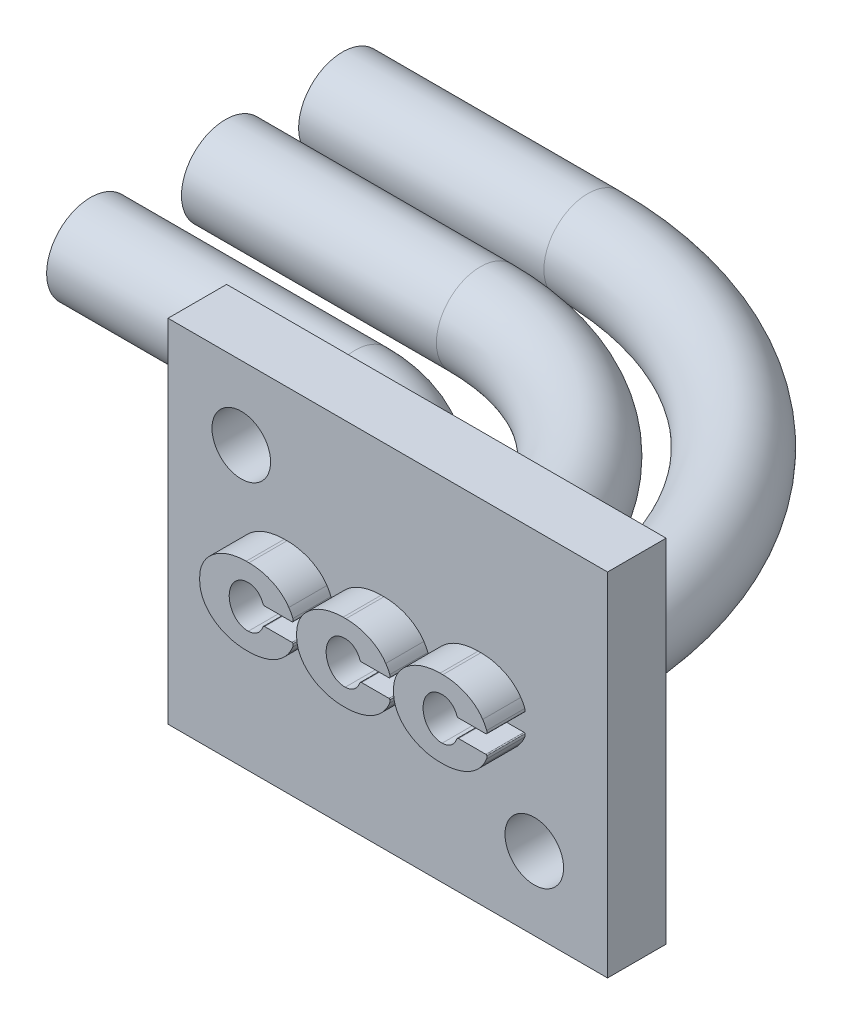
from build123d import *

# Parameters (mm, degrees)
SKETCH1_W           = 15
SKETCH1_H           = 12
BOSS_EXTRUDE1_DEPTH = 2
BOSS_EXTRUDE2_DEPTH = 2
SKETCH3_W           = 1.5
SKETCH3_H           = 4
BOSS_EXTRUDE3_DEPTH = 2
SKETCH12_W          = 14.1
SKETCH12_H          = 8
CUT_EXTRUDE1_DEPTH  = 22.443180832
SKETCH8_R           = 1.5
SKETCH7_R           = 1.5
SKETCH6_R           = 1.5
SKETCH13_R          = 1
CUT_EXTRUDE2_DEPTH  = 24.279403135
CUT_EXTRUDE3_START  = -0.7
CUT_EXTRUDE3_DEPTH  = 0.7


with BuildPart() as part:
    # Sketch1 → Boss-Extrude1 (new body)
    with BuildSketch(Plane.XY):
        Rectangle(SKETCH1_W, SKETCH1_H)
    extrude(amount=BOSS_EXTRUDE1_DEPTH)

    # Sketch2 → Boss-Extrude2 (add)
    with BuildSketch(Plane.XY.offset(2)):
        with BuildLine():
            Line((0.407238435, 0.442322853), (1.343073358, 0.442322853))
            ThreePointArc((1.343073358, 0.442322853), (1.361383578, 0.450410651), (1.372317406, 0.467177524))
            ThreePointArc((1.372317406, 0.467177524), (1.375503859, 0.511169305), (1.368128847, 0.554655388))
            ThreePointArc((1.368128847, 0.554655388), (1.307680997, 0.687640629), (1.230966735, 0.811954502))
            add(Edge.make_bspline(
                [(1.230966735, 0.811954502), (0.812669173, 1.453088874), (-0.130132299, 1.453088874)],
                knots=[0.342748392, 0.342748392, 0.342748392, 1.381331695, 1.381331695, 1.381331695], degree=2, weights=[1, 0.868170926, 1]))
            Line((-0.130132299, 1.453088874), (-0.223753352, 1.45308889))
            add(Edge.make_bspline(
                [(-0.223753352, 1.45308889), (-1.809410214, 1.45308889), (-1.809410214, 0.201933814)],
                knots=[4.81203319, 4.81203319, 4.81203319, 6.344970327, 6.344970327, 6.344970327], degree=2, weights=[1, 0.720364542, 1]))
            Line((-1.809410214, 0.201933814), (-1.809410207, 0.071803559))
            add(Edge.make_bspline(
                [(-1.809410207, 0.071803559), (-1.809410207, -1.179351517), (-0.223753345, -1.179351517)],
                knots=[3.079807634, 3.079807634, 3.079807634, 4.612744771, 4.612744771, 4.612744771], degree=2, weights=[1, 0.720364542, 1]))
            Line((-0.223753345, -1.179351517), (-0.130132292, -1.179351553))
            add(Edge.make_bspline(
                [(-0.130132292, -1.179351553), (0.81266918, -1.179351553), (1.230966742, -0.53821718)],
                knots=[1.760260959, 1.760260959, 1.760260959, 2.798844261, 2.798844261, 2.798844261], degree=2, weights=[1, 0.868170926, 1]))
            ThreePointArc((1.230966742, -0.53821718), (1.304716836, -0.419114346), (1.363380807, -0.291901532))
            ThreePointArc((1.363380807, -0.291901532), (1.374973795, -0.243578219), (1.373211686, -0.193915004))
            ThreePointArc((1.373211686, -0.193915004), (1.361207126, -0.172992015), (1.338547111, -0.164721302))
            Line((1.338547111, -0.164721302), (0.407238389, -0.164721302))
            ThreePointArc((0.407238389, -0.164721302), (0.369470559, -0.176722101), (0.34555702, -0.208322271))
            add(Edge.make_bspline(
                [(-0.150934559, -0.579205825), (0.214173352, -0.579565029), (0.34555702, -0.208322271)],
                knots=[5.955155363, 5.955155363, 5.955155363, 7.020735545, 7.020735545, 7.020735545], degree=2, weights=[1, 0.86139323, 1]))
            add(Edge.make_bspline(
                [(-0.210727715, 0.853430346), (-0.832817449, 0.821972711), (-0.802831579, 0.103515223), (-0.77284571, -0.614942265), (-0.150934559, -0.579205825)],
                knots=[3.181025595, 3.181025595, 3.181025595, 4.754799698, 4.754799698, 6.328573801, 6.328573801, 6.328573801], degree=2, weights=[1, 0.706053195, 1, 0.706053195, 1]))
            add(Edge.make_bspline(
                [(0.345557015, 0.485923858), (0.199318189, 0.899141892), (-0.210727715, 0.853430346)],
                knots=[5.545635094, 5.545635094, 5.545635094, 6.707278348, 6.707278348, 6.707278348], degree=2, weights=[1, 0.836012096, 1]))
            ThreePointArc((0.345557015, 0.485923858), (0.369470574, 0.454323662), (0.407238435, 0.442322853))
        make_face()
        with BuildLine():
            Line((-2.901066111, 0.442322853), (-1.965231187, 0.442322853))
            ThreePointArc((-1.965231187, 0.442322853), (-1.946920937, 0.450410638), (-1.935987089, 0.467177524))
            ThreePointArc((-1.935987089, 0.467177524), (-1.932800635, 0.511169305), (-1.940175648, 0.554655388))
            ThreePointArc((-1.940175648, 0.554655388), (-2.000623497, 0.687640629), (-2.077337759, 0.811954502))
            add(Edge.make_bspline(
                [(-2.077337759, 0.811954502), (-2.495635321, 1.453088874), (-3.438436793, 1.453088874)],
                knots=[0.342748392, 0.342748392, 0.342748392, 1.381331695, 1.381331695, 1.381331695], degree=2, weights=[1, 0.868170926, 1]))
            Line((-3.438436793, 1.453088874), (-3.532057847, 1.45308889))
            add(Edge.make_bspline(
                [(-3.532057847, 1.45308889), (-5.117714708, 1.45308889), (-5.117714708, 0.201933814)],
                knots=[4.81203319, 4.81203319, 4.81203319, 6.344970327, 6.344970327, 6.344970327], degree=2, weights=[1, 0.720364542, 1]))
            Line((-5.117714708, 0.201933814), (-5.117714753, 0.071803559))
            add(Edge.make_bspline(
                [(-5.117714753, 0.071803559), (-5.117714753, -1.179351517), (-3.532057891, -1.179351517)],
                knots=[3.079807634, 3.079807634, 3.079807634, 4.612744771, 4.612744771, 4.612744771], degree=2, weights=[1, 0.720364542, 1]))
            Line((-3.532057891, -1.179351517), (-3.438436838, -1.179351553))
            add(Edge.make_bspline(
                [(-3.438436838, -1.179351553), (-2.495635366, -1.179351553), (-2.077337803, -0.53821718)],
                knots=[4.901853612, 4.901853612, 4.901853612, 5.940436915, 5.940436915, 5.940436915], degree=2, weights=[1, 0.868170926, 1]))
            ThreePointArc((-2.077337803, -0.53821718), (-2.003587709, -0.419114346), (-1.944923738, -0.291901532))
            ThreePointArc((-1.944923738, -0.291901532), (-1.933330751, -0.243578219), (-1.935092859, -0.193915004))
            ThreePointArc((-1.935092859, -0.193915004), (-1.94709742, -0.172992015), (-1.969757434, -0.164721302))
            Line((-1.969757434, -0.164721302), (-2.901066156, -0.164721302))
            ThreePointArc((-2.901066156, -0.164721302), (-2.938833986, -0.176722101), (-2.962747525, -0.208322271))
            add(Edge.make_bspline(
                [(-3.459239104, -0.579205825), (-3.094131193, -0.579565029), (-2.962747525, -0.208322271)],
                knots=[2.81356271, 2.81356271, 2.81356271, 3.879142891, 3.879142891, 3.879142891], degree=2, weights=[1, 0.86139323, 1]))
            add(Edge.make_bspline(
                [(-3.51903226, 0.853430346), (-4.141121994, 0.821972711), (-4.111136125, 0.103515223), (-4.081150255, -0.614942265), (-3.459239104, -0.579205825)],
                knots=[0.039432941, 0.039432941, 0.039432941, 1.613207044, 1.613207044, 3.186981147, 3.186981147, 3.186981147], degree=2, weights=[1, 0.706053195, 1, 0.706053195, 1]))
            add(Edge.make_bspline(
                [(-2.962747531, 0.485923858), (-3.108986357, 0.899141892), (-3.51903226, 0.853430346)],
                knots=[5.545635094, 5.545635094, 5.545635094, 6.707278348, 6.707278348, 6.707278348], degree=2, weights=[1, 0.836012096, 1]))
            ThreePointArc((-2.962747531, 0.485923858), (-2.938833971, 0.454323662), (-2.901066111, 0.442322853))
        make_face()
        with BuildLine():
            Line((3.715542981, 0.442322853), (4.651377904, 0.442322853))
            ThreePointArc((4.651377904, 0.442322853), (4.669688124, 0.450410651), (4.680621952, 0.467177524))
            ThreePointArc((4.680621952, 0.467177524), (4.683808405, 0.511169305), (4.676433393, 0.554655388))
            ThreePointArc((4.676433393, 0.554655388), (4.615985543, 0.687640629), (4.539271281, 0.811954502))
            add(Edge.make_bspline(
                [(4.539271281, 0.811954502), (4.120973719, 1.453088874), (3.178172247, 1.453088874)],
                knots=[0.342748392, 0.342748392, 0.342748392, 1.381331695, 1.381331695, 1.381331695], degree=2, weights=[1, 0.868170926, 1]))
            Line((3.178172247, 1.453088874), (3.084551194, 1.45308889))
            add(Edge.make_bspline(
                [(3.084551194, 1.45308889), (1.498894332, 1.45308889), (1.498894332, 0.201933814)],
                knots=[4.81203319, 4.81203319, 4.81203319, 6.344970327, 6.344970327, 6.344970327], degree=2, weights=[1, 0.720364542, 1]))
            Line((1.498894332, 0.201933814), (1.498894339, 0.071803559))
            add(Edge.make_bspline(
                [(1.498894339, 0.071803559), (1.498894339, -1.179351517), (3.084551201, -1.179351517)],
                knots=[3.079807634, 3.079807634, 3.079807634, 4.612744771, 4.612744771, 4.612744771], degree=2, weights=[1, 0.720364542, 1]))
            Line((3.084551201, -1.179351517), (3.178172254, -1.179351553))
            add(Edge.make_bspline(
                [(3.178172254, -1.179351553), (4.120973726, -1.179351553), (4.539271288, -0.53821718)],
                knots=[1.760260959, 1.760260959, 1.760260959, 2.798844261, 2.798844261, 2.798844261], degree=2, weights=[1, 0.868170926, 1]))
            ThreePointArc((4.539271288, -0.53821718), (4.613021382, -0.419114346), (4.671685353, -0.291901532))
            ThreePointArc((4.671685353, -0.291901532), (4.683278341, -0.243578219), (4.681516232, -0.193915004))
            ThreePointArc((4.681516232, -0.193915004), (4.669511672, -0.172992015), (4.646851657, -0.164721302))
            Line((4.646851657, -0.164721302), (3.715542935, -0.164721302))
            ThreePointArc((3.715542935, -0.164721302), (3.677775105, -0.176722101), (3.653861566, -0.208322271))
            add(Edge.make_bspline(
                [(3.157369987, -0.579205825), (3.522477898, -0.579565029), (3.653861566, -0.208322271)],
                knots=[5.955155363, 5.955155363, 5.955155363, 7.020735545, 7.020735545, 7.020735545], degree=2, weights=[1, 0.86139323, 1]))
            add(Edge.make_bspline(
                [(3.097576831, 0.853430346), (2.475487097, 0.821972711), (2.505472967, 0.103515223), (2.535458836, -0.614942265), (3.157369987, -0.579205825)],
                knots=[3.181025595, 3.181025595, 3.181025595, 4.754799698, 4.754799698, 6.328573801, 6.328573801, 6.328573801], degree=2, weights=[1, 0.706053195, 1, 0.706053195, 1]))
            add(Edge.make_bspline(
                [(3.653861561, 0.485923858), (3.507622735, 0.899141892), (3.097576831, 0.853430346)],
                knots=[5.545635094, 5.545635094, 5.545635094, 6.707278348, 6.707278348, 6.707278348], degree=2, weights=[1, 0.836012096, 1]))
            ThreePointArc((3.653861561, 0.485923858), (3.67777512, 0.454323662), (3.715542981, 0.442322853))
        make_face()
    extrude(amount=BOSS_EXTRUDE2_DEPTH)

    # Sketch3 → Boss-Extrude3 (add, symmetric)
    with BuildSketch(Plane(origin=(0, 0, 0), x_dir=(1, 0, 0), z_dir=(0, 1, 0))):
        Polygon((2.72873188, 0), (4.22873188, 0), (4.22873188, 14.1), (-2.422646748, 14.1), (-2.422646748, 12.6), (2.72873188, 12.6), align=None)
        with Locations((-3.864025386, 2)):
            Rectangle(SKETCH3_W, SKETCH3_H)
        Polygon((-0.942646753, 0), (0.557353247, 0), (0.557353247, 10.1), (-2.642646753, 10.1), (-2.642646753, 8.6), (-0.942646753, 8.6), align=None)
    extrude(amount=BOSS_EXTRUDE3_DEPTH, both=True)

    # Sketch12 → Cut-Extrude1 (cut, through all)
    with BuildSketch(Plane(origin=(7.5, 0, 0), x_dir=(0, 0, -1), z_dir=(1, 0, 0))):
        with Locations((7.05, -2)):
            Rectangle(SKETCH12_W, SKETCH12_H)
    extrude(amount=-CUT_EXTRUDE1_DEPTH, mode=Mode.SUBTRACT)

    # Sweep1: sweep along a path in Sketch9
    with BuildLine(Plane(origin=(0, 0, 0), x_dir=(1, 0, 0), z_dir=(0, 1, 0))) as sweep1_path:
        Line((-3.864025386, 0), (-3.864025386, 0.75))
        ThreePointArc((-3.864025386, 0.75), (-5.035598261, 3.578427125), (-7.864025386, 4.75))
        Line((-7.864025386, 4.75), (-16.894025386, 4.75))
    # Sketch8 → Sweep1 (sweep)
    with BuildSketch(Plane(origin=(0, 0, 0), x_dir=(-1, 0, 0), z_dir=(0, 0, -1))):
        with Locations((3.864025386, 0)):
            Circle(SKETCH8_R)
    sweep(path=sweep1_path.line)

    # Sweep2: sweep along a path in Sketch10
    with BuildLine(Plane(origin=(0, 0, 0), x_dir=(1, 0, 0), z_dir=(0, 1, 0))) as sweep2_path:
        Line((-0.192646753, 0), (-0.192646753, 1.16))
        ThreePointArc((-0.192646753, 1.16), (-2.535792503, 6.816854249), (-8.192646753, 9.16))
        Line((-8.192646753, 9.16), (-16.894025753, 9.16))
    # Sketch7 → Sweep2 (sweep)
    with BuildSketch(Plane(origin=(0, 0, 0), x_dir=(-1, 0, 0), z_dir=(0, 0, -1))):
        Circle(SKETCH7_R)
    sweep(path=sweep2_path.line)

    # Sweep3: sweep along a path in Sketch11
    with BuildLine(Plane(origin=(0, 0, 0), x_dir=(1, 0, 0), z_dir=(0, 1, 0))) as sweep3_path:
        Line((3.47873188, 0), (3.47873188, 1.35))
        ThreePointArc((3.47873188, 1.35), (-0.035986746, 9.835281374), (-8.52126812, 13.35))
        Line((-8.52126812, 13.35), (-16.89402512, 13.35))
    # Sketch6 → Sweep3 (sweep)
    with BuildSketch(Plane(origin=(0, 0, 0), x_dir=(-1, 0, 0), z_dir=(0, 0, -1))):
        with Locations((-3.47873188, 0)):
            Circle(SKETCH6_R)
    sweep(path=sweep3_path.line)

    # Sketch13 → Cut-Extrude2 (cut, through all)
    with BuildSketch(Plane(origin=(0, 0, 0), x_dir=(-1, 0, 0), z_dir=(0, 0, -1))):
        with Locations((-5, -3.5)):
            Circle(SKETCH13_R)
        with Locations((5, 3.5)):
            Circle(SKETCH13_R)
    extrude(amount=-CUT_EXTRUDE2_DEPTH, mode=Mode.SUBTRACT)

    # Sketch15 → Cut-Extrude3 (cut)
    with BuildSketch(Plane.XY.offset(4).offset(CUT_EXTRUDE3_START)):
        with BuildLine():
            Line((-2.901066111, 0.442322853), (-1.965231187, 0.442322853))
            ThreePointArc((-1.965231187, 0.442322853), (-1.946920937, 0.450410638), (-1.935987089, 0.467177524))
            ThreePointArc((-1.935987089, 0.467177524), (-1.932800635, 0.511169305), (-1.940175648, 0.554655388))
            ThreePointArc((-1.940175648, 0.554655388), (-2.000623497, 0.687640629), (-2.077337759, 0.811954502))
            add(Edge.make_bspline(
                [(-2.077337759, 0.811954502), (-2.495635321, 1.453088874), (-3.438436793, 1.453088874)],
                knots=[3.484341046, 3.484341046, 3.484341046, 4.522924348, 4.522924348, 4.522924348], degree=2, weights=[1, 0.868170926, 1]))
            Line((-3.438436793, 1.453088874), (-3.532057847, 1.45308889))
            add(Edge.make_bspline(
                [(-3.532057847, 1.45308889), (-5.117714708, 1.45308889), (-5.117714708, 0.201933814)],
                knots=[4.81203319, 4.81203319, 4.81203319, 6.344970327, 6.344970327, 6.344970327], degree=2, weights=[1, 0.720364542, 1]))
            Line((-5.117714708, 0.201933814), (-5.117714753, 0.071803559))
            add(Edge.make_bspline(
                [(-5.117714753, 0.071803559), (-5.117714753, -1.179351517), (-3.532057891, -1.179351517)],
                knots=[3.079807634, 3.079807634, 3.079807634, 4.612744771, 4.612744771, 4.612744771], degree=2, weights=[1, 0.720364542, 1]))
            Line((-3.532057891, -1.179351517), (-3.438436838, -1.179351553))
            add(Edge.make_bspline(
                [(-3.438436838, -1.179351553), (-2.495635366, -1.179351553), (-2.077337803, -0.53821718)],
                knots=[1.760260959, 1.760260959, 1.760260959, 2.798844261, 2.798844261, 2.798844261], degree=2, weights=[1, 0.868170926, 1]))
            ThreePointArc((-2.077337803, -0.53821718), (-2.003587709, -0.419114346), (-1.944923738, -0.291901532))
            ThreePointArc((-1.944923738, -0.291901532), (-1.933330751, -0.243578219), (-1.935092859, -0.193915004))
            ThreePointArc((-1.935092859, -0.193915004), (-1.94709742, -0.172992015), (-1.969757434, -0.164721302))
            Line((-1.969757434, -0.164721302), (-2.901066156, -0.164721302))
            ThreePointArc((-2.901066156, -0.164721302), (-2.938833986, -0.176722101), (-2.962747525, -0.208322271))
            add(Edge.make_bspline(
                [(-3.459239104, -0.579205825), (-3.094131193, -0.579565029), (-2.962747525, -0.208322271)],
                knots=[5.955155363, 5.955155363, 5.955155363, 7.020735545, 7.020735545, 7.020735545], degree=2, weights=[1, 0.86139323, 1]))
            add(Edge.make_bspline(
                [(-3.51903226, 0.853430346), (-4.141121994, 0.821972711), (-4.111136125, 0.103515223), (-4.081150255, -0.614942265), (-3.459239104, -0.579205825)],
                knots=[3.181025595, 3.181025595, 3.181025595, 4.754799698, 4.754799698, 6.328573801, 6.328573801, 6.328573801], degree=2, weights=[1, 0.706053195, 1, 0.706053195, 1]))
            add(Edge.make_bspline(
                [(-2.962747531, 0.485923858), (-3.108986357, 0.899141892), (-3.51903226, 0.853430346)],
                knots=[2.40404244, 2.40404244, 2.40404244, 3.565685694, 3.565685694, 3.565685694], degree=2, weights=[1, 0.836012096, 1]))
            ThreePointArc((-2.962747531, 0.485923858), (-2.938833971, 0.454323662), (-2.901066111, 0.442322853))
        make_face()
        with BuildLine():
            Line((0.407238435, 0.442322853), (1.343073358, 0.442322853))
            ThreePointArc((1.343073358, 0.442322853), (1.361383578, 0.450410651), (1.372317406, 0.467177524))
            ThreePointArc((1.372317406, 0.467177524), (1.375503859, 0.511169305), (1.368128847, 0.554655388))
            ThreePointArc((1.368128847, 0.554655388), (1.307680997, 0.687640629), (1.230966735, 0.811954502))
            add(Edge.make_bspline(
                [(1.230966735, 0.811954502), (0.812669173, 1.453088874), (-0.130132299, 1.453088874)],
                knots=[0.342748392, 0.342748392, 0.342748392, 1.381331695, 1.381331695, 1.381331695], degree=2, weights=[1, 0.868170926, 1]))
            Line((-0.130132299, 1.453088874), (-0.223753352, 1.45308889))
            add(Edge.make_bspline(
                [(-0.223753352, 1.45308889), (-1.809410214, 1.45308889), (-1.809410214, 0.201933814)],
                knots=[4.81203319, 4.81203319, 4.81203319, 6.344970327, 6.344970327, 6.344970327], degree=2, weights=[1, 0.720364542, 1]))
            Line((-1.809410214, 0.201933814), (-1.809410207, 0.071803559))
            add(Edge.make_bspline(
                [(-1.809410207, 0.071803559), (-1.809410207, -1.179351517), (-0.223753345, -1.179351517)],
                knots=[3.079807634, 3.079807634, 3.079807634, 4.612744771, 4.612744771, 4.612744771], degree=2, weights=[1, 0.720364542, 1]))
            Line((-0.223753345, -1.179351517), (-0.130132292, -1.179351553))
            add(Edge.make_bspline(
                [(-0.130132292, -1.179351553), (0.81266918, -1.179351553), (1.230966742, -0.53821718)],
                knots=[1.760260959, 1.760260959, 1.760260959, 2.798844261, 2.798844261, 2.798844261], degree=2, weights=[1, 0.868170926, 1]))
            ThreePointArc((1.230966742, -0.53821718), (1.304716836, -0.419114346), (1.363380807, -0.291901532))
            ThreePointArc((1.363380807, -0.291901532), (1.374973795, -0.243578219), (1.373211686, -0.193915004))
            ThreePointArc((1.373211686, -0.193915004), (1.361207126, -0.172992015), (1.338547111, -0.164721302))
            Line((1.338547111, -0.164721302), (0.407238389, -0.164721302))
            ThreePointArc((0.407238389, -0.164721302), (0.369470559, -0.176722101), (0.34555702, -0.208322271))
            add(Edge.make_bspline(
                [(-0.150934559, -0.579205825), (0.214173352, -0.579565029), (0.34555702, -0.208322271)],
                knots=[5.955155363, 5.955155363, 5.955155363, 7.020735545, 7.020735545, 7.020735545], degree=2, weights=[1, 0.86139323, 1]))
            add(Edge.make_bspline(
                [(-0.210727715, 0.853430346), (-0.832817449, 0.821972711), (-0.802831579, 0.103515223), (-0.77284571, -0.614942265), (-0.150934559, -0.579205825)],
                knots=[3.181025595, 3.181025595, 3.181025595, 4.754799698, 4.754799698, 6.328573801, 6.328573801, 6.328573801], degree=2, weights=[1, 0.706053195, 1, 0.706053195, 1]))
            add(Edge.make_bspline(
                [(0.345557015, 0.485923858), (0.199318189, 0.899141892), (-0.210727715, 0.853430346)],
                knots=[2.404042441, 2.404042441, 2.404042441, 3.565685694, 3.565685694, 3.565685694], degree=2, weights=[1, 0.836012096, 1]))
            ThreePointArc((0.345557015, 0.485923858), (0.369470574, 0.454323662), (0.407238435, 0.442322853))
        make_face()
        with BuildLine():
            Line((3.715542981, 0.442322853), (4.651377904, 0.442322853))
            ThreePointArc((4.651377904, 0.442322853), (4.669688124, 0.450410651), (4.680621952, 0.467177524))
            ThreePointArc((4.680621952, 0.467177524), (4.683808405, 0.511169305), (4.676433393, 0.554655388))
            ThreePointArc((4.676433393, 0.554655388), (4.615985543, 0.687640629), (4.539271281, 0.811954502))
            add(Edge.make_bspline(
                [(4.539271281, 0.811954502), (4.120973719, 1.453088874), (3.178172247, 1.453088874)],
                knots=[0.342748392, 0.342748392, 0.342748392, 1.381331695, 1.381331695, 1.381331695], degree=2, weights=[1, 0.868170926, 1]))
            Line((3.178172247, 1.453088874), (3.084551194, 1.45308889))
            add(Edge.make_bspline(
                [(3.084551194, 1.45308889), (1.498894332, 1.45308889), (1.498894332, 0.201933814)],
                knots=[1.670440536, 1.670440536, 1.670440536, 3.203377674, 3.203377674, 3.203377674], degree=2, weights=[1, 0.720364542, 1]))
            Line((1.498894332, 0.201933814), (1.498894339, 0.071803559))
            add(Edge.make_bspline(
                [(1.498894339, 0.071803559), (1.498894339, -1.179351517), (3.084551201, -1.179351517)],
                knots=[3.079807634, 3.079807634, 3.079807634, 4.612744771, 4.612744771, 4.612744771], degree=2, weights=[1, 0.720364542, 1]))
            Line((3.084551201, -1.179351517), (3.178172254, -1.179351553))
            add(Edge.make_bspline(
                [(3.178172254, -1.179351553), (4.120973726, -1.179351553), (4.539271288, -0.53821718)],
                knots=[1.760260959, 1.760260959, 1.760260959, 2.798844261, 2.798844261, 2.798844261], degree=2, weights=[1, 0.868170926, 1]))
            ThreePointArc((4.539271288, -0.53821718), (4.613021382, -0.419114346), (4.671685353, -0.291901532))
            ThreePointArc((4.671685353, -0.291901532), (4.683278341, -0.243578219), (4.681516232, -0.193915004))
            ThreePointArc((4.681516232, -0.193915004), (4.669511672, -0.172992015), (4.646851657, -0.164721302))
            Line((4.646851657, -0.164721302), (3.715542935, -0.164721302))
            ThreePointArc((3.715542935, -0.164721302), (3.677775105, -0.176722101), (3.653861566, -0.208322271))
            add(Edge.make_bspline(
                [(3.157369987, -0.579205825), (3.522477898, -0.579565029), (3.653861566, -0.208322271)],
                knots=[5.955155363, 5.955155363, 5.955155363, 7.020735545, 7.020735545, 7.020735545], degree=2, weights=[1, 0.86139323, 1]))
            add(Edge.make_bspline(
                [(3.097576831, 0.853430346), (2.475487097, 0.821972711), (2.505472967, 0.103515223), (2.535458836, -0.614942265), (3.157369987, -0.579205825)],
                knots=[3.181025595, 3.181025595, 3.181025595, 4.754799698, 4.754799698, 6.328573801, 6.328573801, 6.328573801], degree=2, weights=[1, 0.706053195, 1, 0.706053195, 1]))
            add(Edge.make_bspline(
                [(3.653861561, 0.485923858), (3.507622735, 0.899141892), (3.097576831, 0.853430346)],
                knots=[2.404042441, 2.404042441, 2.404042441, 3.565685694, 3.565685694, 3.565685694], degree=2, weights=[1, 0.836012096, 1]))
            ThreePointArc((3.653861561, 0.485923858), (3.67777512, 0.454323662), (3.715542981, 0.442322853))
        make_face()
    extrude(amount=CUT_EXTRUDE3_DEPTH, mode=Mode.SUBTRACT)


solid = part.part
